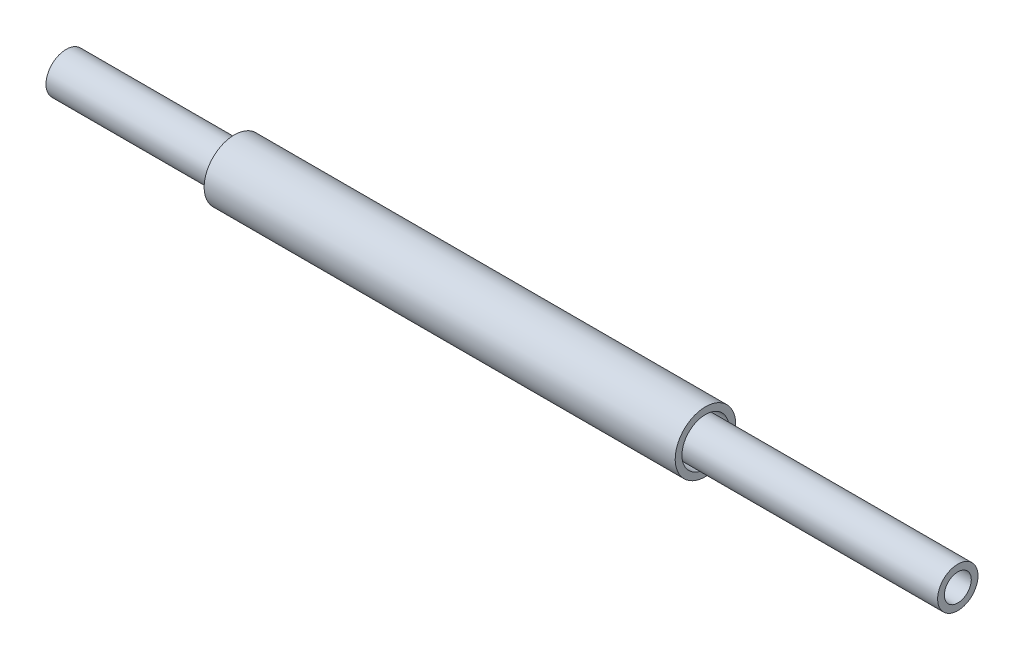
from build123d import *

# Parameters (mm, degrees)
SKETCH1_W      = 5300
SKETCH1_H      = 40
REVOLVE1_ANGLE = 359.999999589
SKETCH2_W      = 2800
SKETCH2_H      = 40
REVOLVE2_ANGLE = 359.999999589


with BuildPart() as part:
    # Sketch1 → Revolve1 (revolve)
    with BuildSketch(Plane.XY):
        with Locations((3550, 100)):
            Rectangle(SKETCH1_W, SKETCH1_H)
    revolve(axis=Axis((0, 0, 0), (1, 0, 0)), revolution_arc=REVOLVE1_ANGLE)


with BuildPart() as body_2:
    # Sketch2 → Revolve2 (revolve)
    with BuildSketch(Plane.XY):
        with Locations((3300, 160)):
            Rectangle(SKETCH2_W, SKETCH2_H)
    revolve(axis=Axis((0, 0, 0), (1, 0, 0)), revolution_arc=REVOLVE2_ANGLE)


solid = Compound([part.part, body_2.part])
